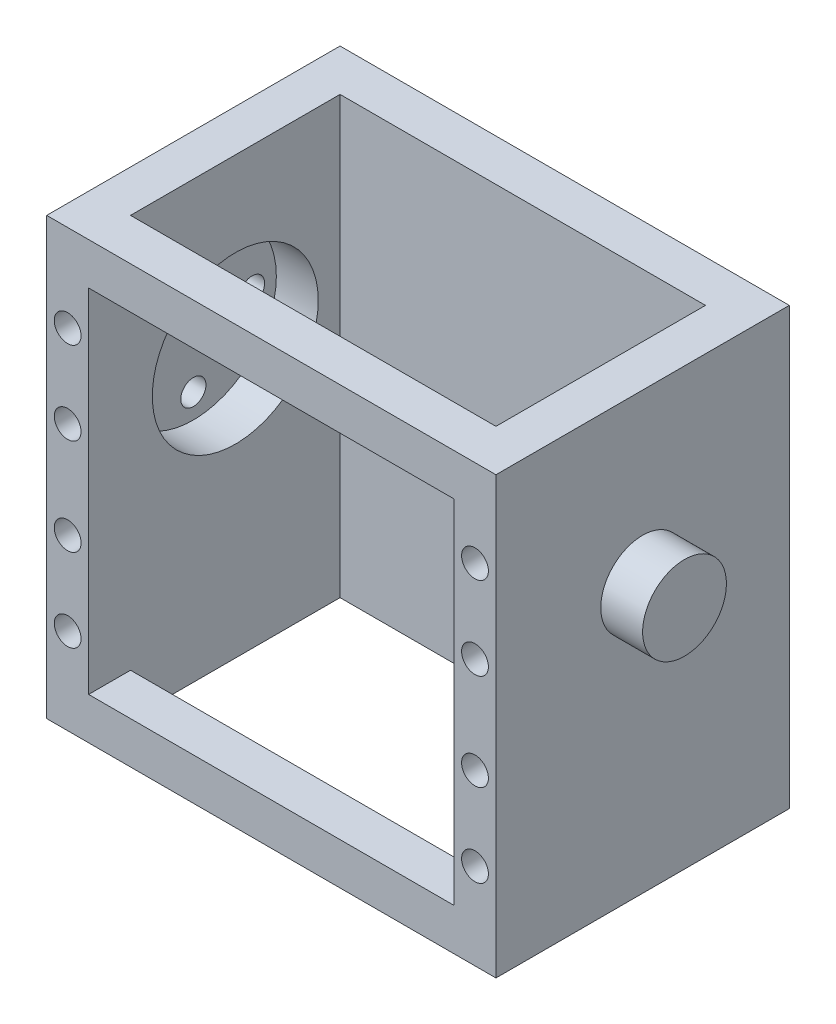
from build123d import *

# Parameters (mm, degrees)
SKETCH1_W           = 53.6
SKETCH1_H           = 35
SKETCH1_W_2         = 43.6
SKETCH1_H_2         = 25
BOSS_EXTRUDE1_DEPTH = 52
SKETCH2_W           = 43.6
SKETCH2_H           = 42
CUT_EXTRUDE1_DEPTH  = 5
SKETCH3_R           = 1.6
SKETCH3_W           = 40
SKETCH3_H           = 20.5
CUT_EXTRUDE2_DEPTH  = 5
SKETCH7_R           = 9.9
SKETCH7_R_2         = 1.5
BOSS_EXTRUDE4_DEPTH = 3
SKETCH8_R           = 9.9
CUT_EXTRUDE4_DEPTH  = 5
SKETCH9_R           = 5
BOSS_EXTRUDE5_DEPTH = 5


with BuildPart() as part:
    # Sketch1 → Boss-Extrude1 (new body)
    with BuildSketch(Plane(origin=(0, 0, 0), x_dir=(1, 0, 0), z_dir=(0, 1, 0))):
        with Locations((26.8, -17.5)):
            Rectangle(SKETCH1_W, SKETCH1_H)
        with Locations((26.8, -17.5)):
            Rectangle(SKETCH1_W_2, SKETCH1_H_2, mode=Mode.SUBTRACT)
    extrude(amount=BOSS_EXTRUDE1_DEPTH)

    # Sketch2 → Cut-Extrude1 (cut)
    with BuildSketch(Plane.XY.offset(35)):
        with Locations((26.8, 26)):
            Rectangle(SKETCH2_W, SKETCH2_H)
    extrude(amount=-CUT_EXTRUDE1_DEPTH, mode=Mode.SUBTRACT)

    # Sketch3 → Cut-Extrude2 (cut)
    with BuildSketch(Plane.XY.offset(35)):
        with Locations((51.1, 20.2)):
            Circle(SKETCH3_R)
        with Locations((51.1, 10.3)):
            Circle(SKETCH3_R)
        with Locations((2.5, 10.3)):
            Circle(SKETCH3_R)
        with Locations((2.5, 20.2)):
            Circle(SKETCH3_R)
        with Locations((51.1, 41.6)):
            Circle(SKETCH3_R)
        with Locations((51.1, 31.7)):
            Circle(SKETCH3_R)
        with Locations((2.5, 31.7)):
            Circle(SKETCH3_R)
        with Locations((2.5, 41.6)):
            Circle(SKETCH3_R)
        with Locations((26.8, 15.25)):
            Rectangle(SKETCH3_W, SKETCH3_H)
        with Locations((26.8, 36.65)):
            Rectangle(SKETCH3_W, SKETCH3_H)
    extrude(amount=-CUT_EXTRUDE2_DEPTH, mode=Mode.SUBTRACT)

    # Sketch7 → Boss-Extrude4 (add)
    with BuildSketch(Plane.ZY):
        with Locations((17.5, 32)):
            Circle(SKETCH7_R)
        with Locations((17.5, 39)):
            Circle(SKETCH7_R_2, mode=Mode.SUBTRACT)
        with Locations((24.5, 32)):
            Circle(SKETCH7_R_2, mode=Mode.SUBTRACT)
        with Locations((17.5, 25)):
            Circle(SKETCH7_R_2, mode=Mode.SUBTRACT)
        with Locations((10.5, 32)):
            Circle(SKETCH7_R_2, mode=Mode.SUBTRACT)
        with Locations((17.5, 32)):
            Circle(SKETCH7_R_2, mode=Mode.SUBTRACT)
    extrude(amount=BOSS_EXTRUDE4_DEPTH)

    # Sketch8 → Cut-Extrude4 (cut)
    with BuildSketch(Plane(origin=(5, 0, 0), x_dir=(0, 0, -1), z_dir=(1, 0, 0))):
        with Locations((-17.5, 32)):
            Circle(SKETCH8_R)
    extrude(amount=-CUT_EXTRUDE4_DEPTH, mode=Mode.SUBTRACT)


with BuildPart() as cut_extrude4_piece_1:
    # of the separate pieces the step leaves, piece 1, a body of its own (cut_extrude4_pieces)
    add(part.part.solids().sort_by_distance((0, 0, 0))[0])

    # Sketch9 → Boss-Extrude5 (add)
    with BuildSketch(Plane(origin=(53.6, 0, 0), x_dir=(0, 0, -1), z_dir=(1, 0, 0))):
        with Locations((-17.5, 32)):
            Circle(SKETCH9_R)
    extrude(amount=BOSS_EXTRUDE5_DEPTH)


with BuildPart() as cut_extrude4_piece_2:
    # of the separate pieces the step leaves, piece 2, a body of its own (cut_extrude4_pieces)
    add(part.part.solids().sort_by_distance((-3, 32, 27.4))[0])


solid = Compound([cut_extrude4_piece_1.part, cut_extrude4_piece_2.part])
